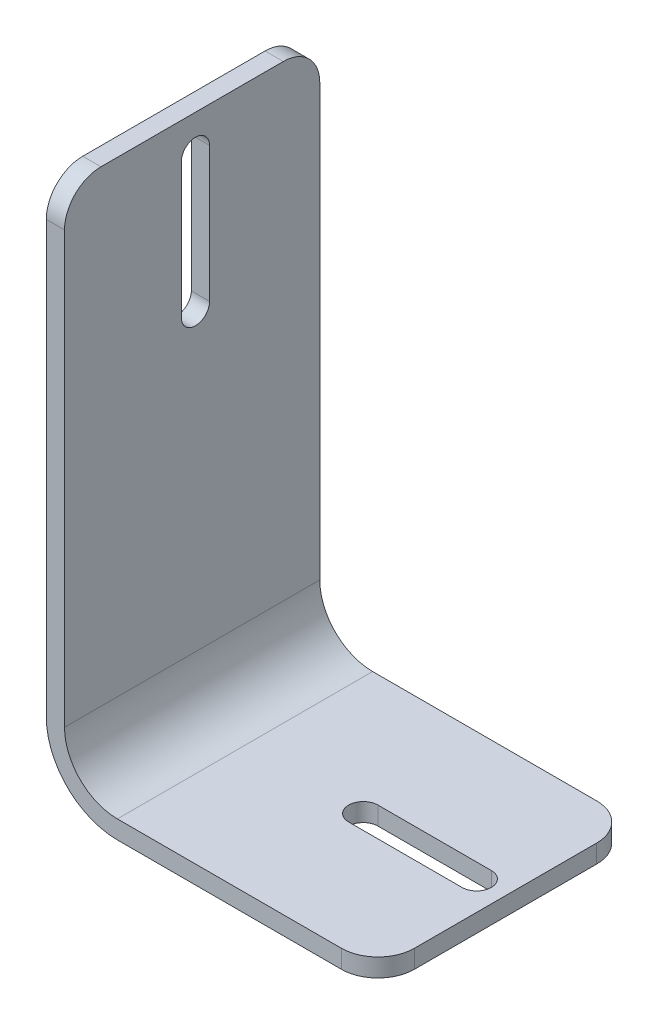
from build123d import *

# Parameters (mm, degrees)
EXTRUDE_THIN1_DEPTH = 35.56
FILLET1_R           = 5.08
CUT_EXTRUDE1_DEPTH  = 71.199112173
CUT_EXTRUDE2_DEPTH  = 92.762357485


with BuildPart() as part:
    # Sketch1 → Extrude-Thin1 (new body)
    with BuildSketch(Plane.XY):
        with BuildLine():
            Line((0, 41.918998188), (0, -23.169286538))
            ThreePointArc((0, -23.169286538), (2.157439192, -28.377805495), (7.365958148, -30.535244686))
            Line((7.365958148, -30.535244686), (43.660042841, -30.535244686))
            Line((43.660042841, -30.535244686), (43.660042841, -33.075244686))
            Line((43.660042841, -33.075244686), (7.365958148, -33.075244686))
            ThreePointArc((7.365958148, -33.075244686), (0.361387967, -30.173856719), (-2.54, -23.169286538))
            Line((-2.54, -23.169286538), (-2.54, 41.918998188))
            Line((-2.54, 41.918998188), (0, 41.918998188))
        make_face()
    extrude(amount=EXTRUDE_THIN1_DEPTH)

    # Fillet1
    fillet1_edges = [part.edges().sort_by_distance(p)[0] for p in [
        (-1.27, 41.918998188, 35.56),
        (-1.27, 41.918998188, 0),
        (43.660042841, -31.805244686, 35.56),
        (43.660042841, -31.805244686, 0),
    ]]
    fillet(fillet1_edges, radius=FILLET1_R)

    # Sketch2 → Cut-Extrude1 (cut, through all)
    with BuildSketch(Plane(origin=(0, 0, 0), x_dir=(0, 0, -1), z_dir=(1, 0, 0))):
        with BuildLine():
            Line((-15.353557986, 36.934347618), (-15.353557986, 18.119499612))
            ThreePointArc((-15.353557986, 18.119499612), (-17.317745415, 16.155312183), (-19.281932844, 18.119499612))
            Line((-19.281932844, 18.119499612), (-19.281932844, 36.934347618))
            ThreePointArc((-19.281932844, 36.934347618), (-17.317745415, 38.898535047), (-15.353557986, 36.934347618))
        make_face()
    extrude(amount=-CUT_EXTRUDE1_DEPTH, mode=Mode.SUBTRACT)

    # Sketch3 → Cut-Extrude2 (cut, through all)
    with BuildSketch(Plane(origin=(0, -30.535244686, 0), x_dir=(1, 0, 0), z_dir=(0, 1, 0))):
        with BuildLine():
            Line((39.637430097, -19.821656487), (23.84441046, -19.821656487))
            ThreePointArc((23.84441046, -19.821656487), (21.802753973, -17.78), (23.84441046, -15.738343513))
            Line((23.84441046, -15.738343513), (39.637430097, -15.738343513))
            ThreePointArc((39.637430097, -15.738343513), (41.679086584, -17.78), (39.637430097, -19.821656487))
        make_face()
    extrude(amount=-CUT_EXTRUDE2_DEPTH, mode=Mode.SUBTRACT)


solid = part.part
